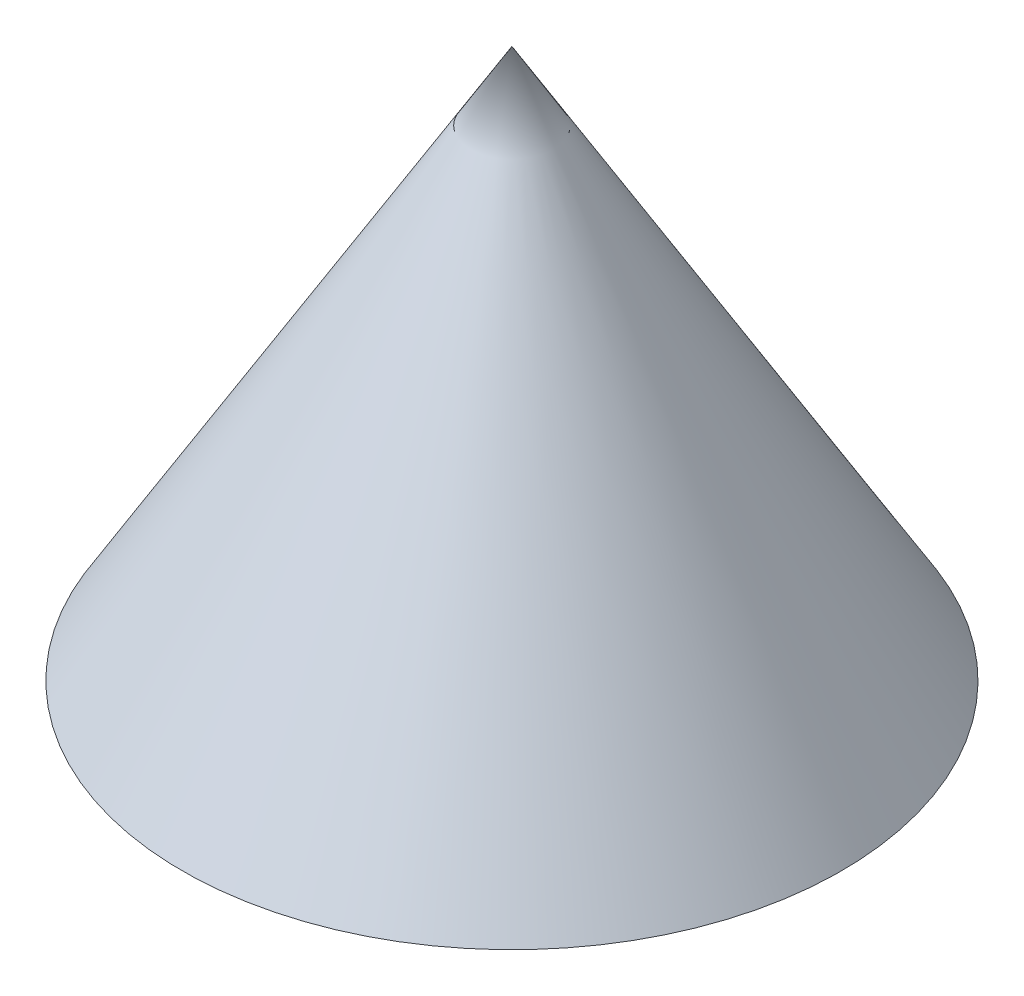
from build123d import *


with BuildPart() as part:
    # 草图1 → 旋转1 (revolve)
    with BuildSketch(Plane.XY, mode=Mode.PRIVATE) as revolve_1_sk:
        Polygon((0, 0), (150, 0), (0, 250), align=None)
    revolve(revolve_1_sk.sketch.rotate(Axis((0, -100, 0), (0, 1, 0)), 90), axis=Axis((0, -100, 0), (0, 1, 0)))


solid = part.part
